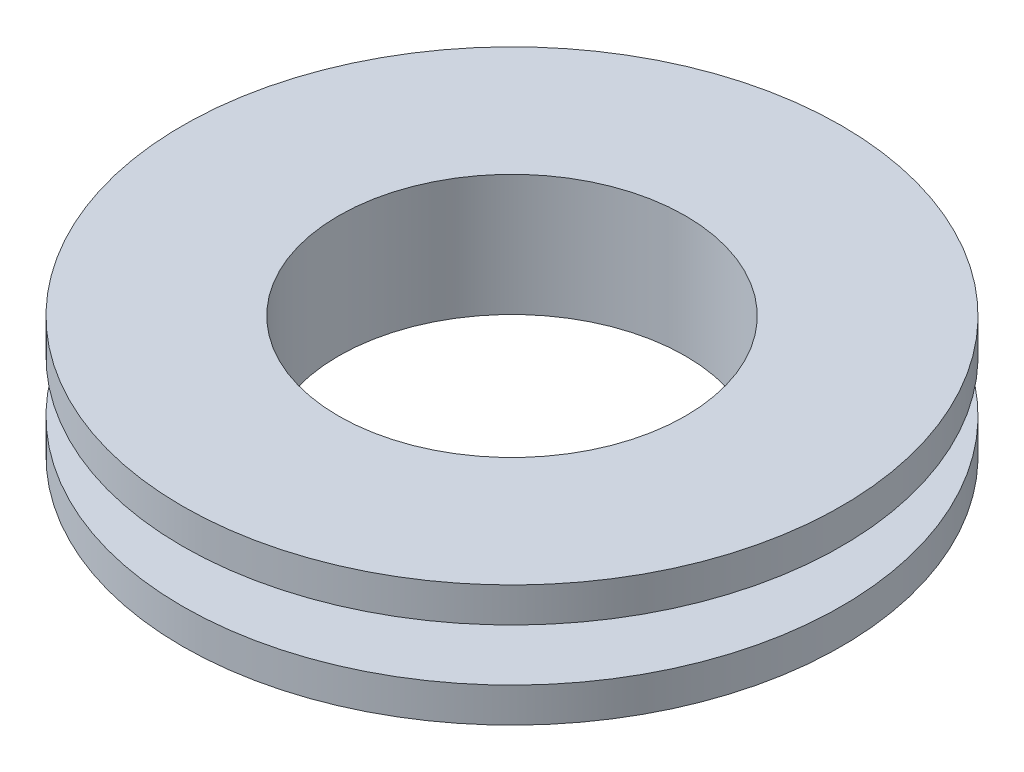
from build123d import *

# Parameters (mm, degrees)
SKETCH_1_R      = 9.5
SKETCH_1_R_2    = 5
EXTRUDE_1_DEPTH = 1
SKETCH_2_R      = 6
SKETCH_2_R_2    = 5
EXTRUDE_2_DEPTH = 1.5
SKETCH_3_R      = 9.5
SKETCH_3_R_2    = 5
EXTRUDE_3_DEPTH = 1


with BuildPart() as part:
    # 草图1 → 凸台-拉伸1 (new body)
    with BuildSketch(Plane(origin=(0, 0, 0), x_dir=(1, 0, 0), z_dir=(0, 1, 0))):
        with Locations(Location((0, 0, 0), (0, 0, 270))):
            Circle(SKETCH_1_R)
        with Locations(Location((0, 0, 0), (0, 0, 270))):
            Circle(SKETCH_1_R_2, mode=Mode.SUBTRACT)
    extrude(amount=EXTRUDE_1_DEPTH)

    # 草图2 → 凸台-拉伸2 (add)
    with BuildSketch(Plane(origin=(0, 1, 0), x_dir=(1, 0, 0), z_dir=(0, 1, 0))):
        with Locations(Location((0, 0, 0), (0, 0, 270))):
            Circle(SKETCH_2_R)
        with Locations(Location((0, 0, 0), (0, 0, 270))):
            Circle(SKETCH_2_R_2, mode=Mode.SUBTRACT)
    extrude(amount=EXTRUDE_2_DEPTH)

    # 草图3 → 凸台-拉伸3 (add)
    with BuildSketch(Plane(origin=(0, 2.5, 0), x_dir=(1, 0, 0), z_dir=(0, 1, 0))):
        with Locations(Location((0, 0, 0), (0, 0, 270))):
            Circle(SKETCH_3_R)
        with Locations(Location((0, 0, 0), (0, 0, 270))):
            Circle(SKETCH_3_R_2, mode=Mode.SUBTRACT)
    extrude(amount=EXTRUDE_3_DEPTH)


solid = part.part
